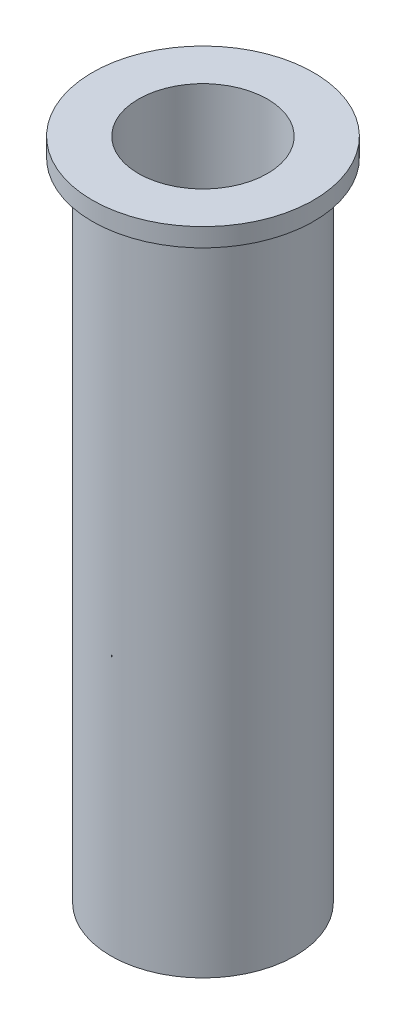
from build123d import *

# Parameters (mm, degrees)
SKETCH4_R               = 10
BOSS_EXTRUDE2_DEPTH     = 70
SKETCH5_R               = 12
BOSS_EXTRUDE3_DEPTH     = 2
CUT_EXTRUDE1_REACH      = 75.973
SKETCH6_R               = 7
CUT_EXTRUDE3_REACH      = 75.973
SKETCH7_R               = 3
CUT_EXTRUDE5_DEPTH      = 1
CUT_EXTRUDE5_DEPTH_BACK = 74.972968133


with BuildPart() as part:
    # Sketch4 → Boss-Extrude2 (new body)
    with BuildSketch(Plane(origin=(0, 0, 0), x_dir=(1, 0, 0), z_dir=(0, 1, 0))):
        Circle(SKETCH4_R)
    extrude(amount=BOSS_EXTRUDE2_DEPTH)

    # Sketch5 → Boss-Extrude3 (add)
    with BuildSketch(Plane(origin=(0, 70, 0), x_dir=(1, 0, 0), z_dir=(0, 1, 0))):
        Circle(SKETCH5_R)
    extrude(amount=BOSS_EXTRUDE3_DEPTH)

    # Sketch6 → Cut-Extrude1 (cut, up to next)
    with BuildSketch(Plane.XZ, mode=Mode.PRIVATE) as cut_extrude1_sk1:
        Circle(SKETCH6_R)
    cut_extrude1_tool1 = extrude(cut_extrude1_sk1.sketch, amount=-CUT_EXTRUDE1_REACH, mode=Mode.PRIVATE) & part.part
    add(cut_extrude1_tool1.solids().sort_by_distance((0, 0, 0))[0], mode=Mode.SUBTRACT)

    # Sketch7 → Cut-Extrude3 (cut, up to next)
    with BuildSketch(Plane(origin=(0, 0, 0), x_dir=(0, 0, -1), z_dir=(1, 0, 0)), mode=Mode.PRIVATE) as cut_extrude3_sk1:
        with Locations((0, 16)):
            Circle(SKETCH7_R)
    cut_extrude3_tool1 = extrude(cut_extrude3_sk1.sketch, amount=-CUT_EXTRUDE3_REACH, mode=Mode.PRIVATE) & part.part
    add(cut_extrude3_tool1.solids().sort_by_distance((0, 16, 0))[0], mode=Mode.SUBTRACT)

    # Sketch7<4> → Cut-Extrude5 (cut, two sides: drawn at the far end of the back side and taken through both)
    with BuildSketch(Plane(origin=(0, 0, 0), x_dir=(0, 0, -1), z_dir=(1, 0, 0)).offset(-CUT_EXTRUDE5_DEPTH_BACK)):
        with BuildLine():
            ThreePointArc((2, 58), (0, 60), (-2, 58))
            Line((-2, 58), (-2, 48))
            ThreePointArc((-2, 48), (0, 46), (2, 48))
            Line((2, 48), (2, 58))
        make_face()
    extrude(amount=CUT_EXTRUDE5_DEPTH + CUT_EXTRUDE5_DEPTH_BACK, mode=Mode.SUBTRACT)


solid = part.part
